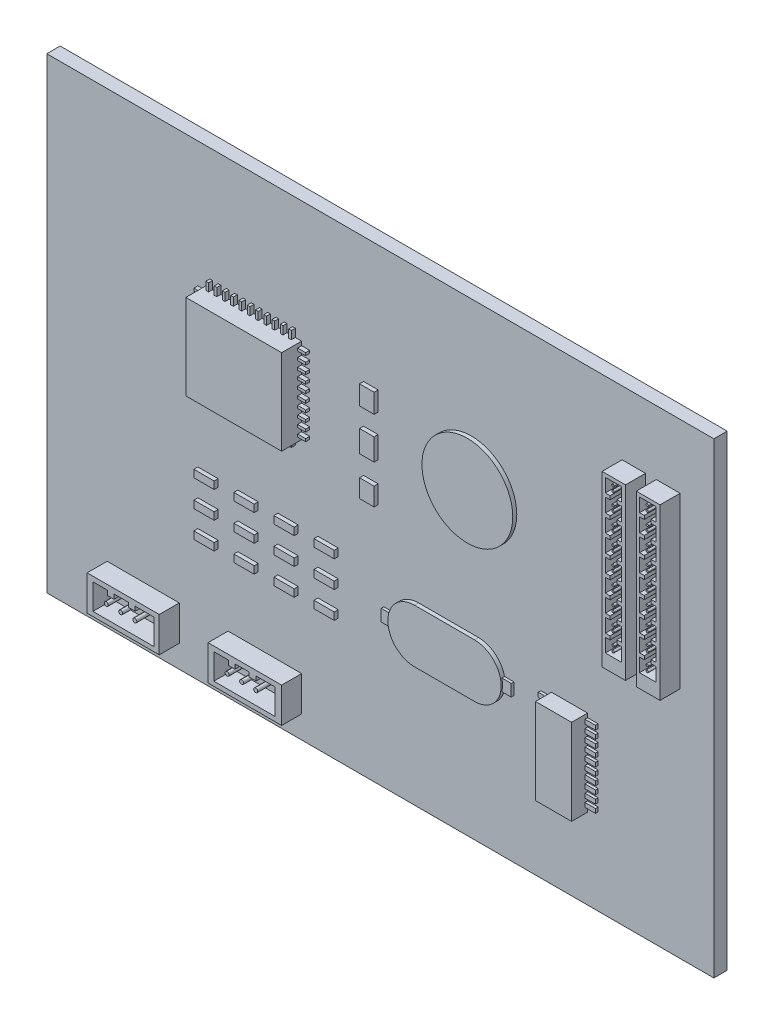
from build123d import *

# Parameters (mm, degrees)
SKETCH_1_W          = 50
SKETCH_1_H          = 35
EXTRUDE_1_DEPTH     = 1
SKETCH_2_W          = 7.176497208
SKETCH_2_H          = 6.396443163
SKETCH_2_W_2        = 5.406033325
SKETCH_2_H_2        = 2.621107066
SKETCH_2_W_3        = 5.514100591
SKETCH_2_W_4        = 1.753496487
SKETCH_2_H_3        = 12.698631261
SKETCH_2_W_5        = 1.780960435
EXTRUDE_2_DEPTH     = 1.5
SKETCH_3_R          = 3.403415583
SKETCH_3_W          = 0.2
SKETCH_3_H          = 0.6
SKETCH_3_W_2        = 0.6
SKETCH_3_H_2        = 0.2
SKETCH_3_W_3        = 1.52
SKETCH_3_H_3        = 0.553688952
SKETCH_3_W_4        = 1.08844173
SKETCH_3_H_4        = 1.44
SKETCH_3_H_5        = 1.641778418
SKETCH_3_H_6        = 1.356241209
EXTRUDE_3_DEPTH     = 0.3
SKETCH_4_R          = 0.15
SKETCH_4_R_2        = 0.085284689
CUT_EXTRUDE_1_DEPTH = 1.5
SKETCH_5_W          = 2.708520987
SKETCH_5_H          = 6.432737344
EXTRUDE_4_DEPTH     = 1.2
SKETCH_6_W          = 0.793035076
SKETCH_6_H          = 0.317513795
SKETCH_6_W_2        = 0.702600128
SKETCH_6_H_2        = 0.89036304
SKETCH_6_W_3        = 0.839915443
EXTRUDE_5_DEPTH     = 0.2


with BuildPart() as part:
    # 草图1 → 凸台-拉伸1 (new body)
    with BuildSketch(Plane.XY):
        Rectangle(SKETCH_1_W, SKETCH_1_H)
    extrude(amount=EXTRUDE_1_DEPTH)

    # 草图2 → 凸台-拉伸2 (add)
    with BuildSketch(Plane.XY.offset(1)):
        with Locations((-9.486885032, 5.195220798)):
            Rectangle(SKETCH_2_W, SKETCH_2_H)
        with Locations((-17.774382296, -14.497998462)):
            Rectangle(SKETCH_2_W_2, SKETCH_2_H_2)
        with Locations((-8.655686724, -14.497998462)):
            Rectangle(SKETCH_2_W_3, SKETCH_2_H_2)
        with Locations((18.999127982, 6.349315631)):
            Rectangle(SKETCH_2_W_4, SKETCH_2_H_3)
        with Locations((21.575662515, 6.349315631)):
            Rectangle(SKETCH_2_W_5, SKETCH_2_H_3)
    extrude(amount=EXTRUDE_2_DEPTH)

    # 草图3 → 凸台-拉伸3 (add)
    with BuildSketch(Plane.XY.offset(1)):
        with Locations((6.823687934, 5.195220797)):
            Circle(SKETCH_3_R)
        with Locations((-12.675133636, 8.693442379)):
            Rectangle(SKETCH_3_W, SKETCH_3_H)
        with Locations((-12.055133636, 8.693442379)):
            Rectangle(SKETCH_3_W, SKETCH_3_H)
        with Locations((-11.435133636, 8.693442379)):
            Rectangle(SKETCH_3_W, SKETCH_3_H)
        with Locations((-10.815133636, 8.693442379)):
            Rectangle(SKETCH_3_W, SKETCH_3_H)
        with Locations((-10.195133636, 8.693442379)):
            Rectangle(SKETCH_3_W, SKETCH_3_H)
        with Locations((-9.575133636, 8.693442379)):
            Rectangle(SKETCH_3_W, SKETCH_3_H)
        with Locations((-8.955133636, 8.693442379)):
            Rectangle(SKETCH_3_W, SKETCH_3_H)
        with Locations((-8.335133636, 8.693442379)):
            Rectangle(SKETCH_3_W, SKETCH_3_H)
        with Locations((-7.715133636, 8.693442379)):
            Rectangle(SKETCH_3_W, SKETCH_3_H)
        with Locations((-7.095133636, 8.693442379)):
            Rectangle(SKETCH_3_W, SKETCH_3_H)
        with Locations((-6.475133636, 8.693442379)):
            Rectangle(SKETCH_3_W, SKETCH_3_H)
        with Locations((-6.475133636, 1.696999216)):
            Rectangle(SKETCH_3_W, SKETCH_3_H)
        with Locations((-7.095133636, 1.696999216)):
            Rectangle(SKETCH_3_W, SKETCH_3_H)
        with Locations((-7.715133636, 1.696999216)):
            Rectangle(SKETCH_3_W, SKETCH_3_H)
        with Locations((-8.335133636, 1.696999216)):
            Rectangle(SKETCH_3_W, SKETCH_3_H)
        with Locations((-8.955133636, 1.696999216)):
            Rectangle(SKETCH_3_W, SKETCH_3_H)
        with Locations((-9.575133636, 1.696999216)):
            Rectangle(SKETCH_3_W, SKETCH_3_H)
        with Locations((-10.195133636, 1.696999216)):
            Rectangle(SKETCH_3_W, SKETCH_3_H)
        with Locations((-10.815133636, 1.696999216)):
            Rectangle(SKETCH_3_W, SKETCH_3_H)
        with Locations((-11.435133636, 1.696999216)):
            Rectangle(SKETCH_3_W, SKETCH_3_H)
        with Locations((-12.055133636, 1.696999216)):
            Rectangle(SKETCH_3_W, SKETCH_3_H)
        with Locations((-12.675133636, 1.696999216)):
            Rectangle(SKETCH_3_W, SKETCH_3_H)
        with Locations((-13.375133636, 7.993442379)):
            Rectangle(SKETCH_3_W_2, SKETCH_3_H_2)
        with Locations((-13.375133636, 7.373442379)):
            Rectangle(SKETCH_3_W_2, SKETCH_3_H_2)
        with Locations((-13.375133636, 6.753442379)):
            Rectangle(SKETCH_3_W_2, SKETCH_3_H_2)
        with Locations((-13.375133636, 6.133442379)):
            Rectangle(SKETCH_3_W_2, SKETCH_3_H_2)
        with Locations((-13.375133636, 5.513442379)):
            Rectangle(SKETCH_3_W_2, SKETCH_3_H_2)
        with Locations((-13.375133636, 4.893442379)):
            Rectangle(SKETCH_3_W_2, SKETCH_3_H_2)
        with Locations((-13.375133636, 4.273442379)):
            Rectangle(SKETCH_3_W_2, SKETCH_3_H_2)
        with Locations((-13.375133636, 3.653442379)):
            Rectangle(SKETCH_3_W_2, SKETCH_3_H_2)
        with Locations((-13.375133636, 3.033442379)):
            Rectangle(SKETCH_3_W_2, SKETCH_3_H_2)
        with Locations((-13.375133636, 2.413442379)):
            Rectangle(SKETCH_3_W_2, SKETCH_3_H_2)
        with Locations((-5.598636428, 2.413442379)):
            Rectangle(SKETCH_3_W_2, SKETCH_3_H_2)
        with Locations((-5.598636428, 3.033442379)):
            Rectangle(SKETCH_3_W_2, SKETCH_3_H_2)
        with Locations((-5.598636428, 3.653442379)):
            Rectangle(SKETCH_3_W_2, SKETCH_3_H_2)
        with Locations((-5.598636428, 4.273442379)):
            Rectangle(SKETCH_3_W_2, SKETCH_3_H_2)
        with Locations((-5.598636428, 4.893442379)):
            Rectangle(SKETCH_3_W_2, SKETCH_3_H_2)
        with Locations((-5.598636428, 5.513442379)):
            Rectangle(SKETCH_3_W_2, SKETCH_3_H_2)
        with Locations((-5.598636428, 6.133442379)):
            Rectangle(SKETCH_3_W_2, SKETCH_3_H_2)
        with Locations((-5.598636428, 6.753442379)):
            Rectangle(SKETCH_3_W_2, SKETCH_3_H_2)
        with Locations((-5.598636428, 7.373442379)):
            Rectangle(SKETCH_3_W_2, SKETCH_3_H_2)
        with Locations((-5.598636428, 7.993442379)):
            Rectangle(SKETCH_3_W_2, SKETCH_3_H_2)
        with Locations((-9.915133636, -3.941136856)):
            Rectangle(SKETCH_3_W_3, SKETCH_3_H_3)
        with Locations((-12.915133636, -3.941136856)):
            Rectangle(SKETCH_3_W_3, SKETCH_3_H_3)
        with Locations((-6.915133636, -3.941136856)):
            Rectangle(SKETCH_3_W_3, SKETCH_3_H_3)
        with Locations((-3.915133636, -3.941136856)):
            Rectangle(SKETCH_3_W_3, SKETCH_3_H_3)
        with Locations((-9.915133636, -5.941136856)):
            Rectangle(SKETCH_3_W_3, SKETCH_3_H_3)
        with Locations((-6.915133636, -5.941136856)):
            Rectangle(SKETCH_3_W_3, SKETCH_3_H_3)
        with Locations((-3.915133636, -5.941136856)):
            Rectangle(SKETCH_3_W_3, SKETCH_3_H_3)
        with Locations((-9.915133636, -7.941136856)):
            Rectangle(SKETCH_3_W_3, SKETCH_3_H_3)
        with Locations((-6.915133636, -7.941136856)):
            Rectangle(SKETCH_3_W_3, SKETCH_3_H_3)
        with Locations((-3.915133636, -7.941136856)):
            Rectangle(SKETCH_3_W_3, SKETCH_3_H_3)
        with Locations((-12.915133636, -5.941136856)):
            Rectangle(SKETCH_3_W_3, SKETCH_3_H_3)
        with Locations((-12.915133636, -7.941136856)):
            Rectangle(SKETCH_3_W_3, SKETCH_3_H_3)
        with BuildLine():
            Line((2.861883395, -8.217981332), (7.358028234, -8.217981332))
            ThreePointArc((7.358028234, -8.217981332), (9.358028234, -6.217981332), (7.358028234, -4.217981332))
            Line((7.358028234, -4.217981332), (2.861883395, -4.217981332))
            ThreePointArc((2.861883395, -4.217981332), (0.861883395, -6.217981332), (2.861883395, -8.217981332))
        make_face()
        with Locations((-0.710216203, 7.373442379)):
            Rectangle(SKETCH_3_W_4, SKETCH_3_H_4)
        with Locations((-0.710216203, 4.374331588)):
            Rectangle(SKETCH_3_W_4, SKETCH_3_H_5)
        with Locations((-0.710216203, 1.318878612)):
            Rectangle(SKETCH_3_W_4, SKETCH_3_H_6)
    extrude(amount=EXTRUDE_3_DEPTH)

    # 草图4 → 切除-拉伸1 (cut)
    # profile 1 of 4: a face of its own
    with BuildSketch(Plane.XY.offset(2.5)):
        Polygon((-18.466780594, -13.552666538), (-17.390825934, -13.552666538), (-17.390825934, -13.875964238), (-16.870429562, -13.875964238), (-16.870429562, -13.552666538), (-15.448688183, -13.552666538), (-15.448688183, -15.471795699), (-20.042348409, -15.471795699), (-20.042348409, -13.552666538), (-18.959047432, -13.552666538), (-18.959047432, -13.904093772), (-18.466780594, -13.904093772), align=None)
        with Locations((-19.043436033, -14.494813977)):
            Circle(SKETCH_4_R, mode=Mode.SUBTRACT)
        with Locations((-17.960448989, -14.494813977)):
            Circle(SKETCH_4_R, mode=Mode.SUBTRACT)
        with Locations((-16.905591479, -14.494813977)):
            Circle(SKETCH_4_R, mode=Mode.SUBTRACT)
    # profile 2 of 4: a face of its own
    with BuildSketch(Plane.XY.offset(2.5)):
        Polygon((-9.894385493, -13.904093772), (-9.402118655, -13.904093772), (-9.402118655, -13.552666538), (-8.326163995, -13.552666538), (-8.326163995, -13.875964238), (-7.805767624, -13.875964238), (-7.805767624, -13.552666538), (-6.384026244, -13.552666538), (-6.384026244, -15.471795699), (-10.97768647, -15.471795699), (-10.97768647, -13.552666538), (-9.894385493, -13.552666538), align=None)
        with Locations((-9.978774094, -14.494813977)):
            Circle(SKETCH_4_R, mode=Mode.SUBTRACT)
        with Locations((-8.895787051, -14.494813977)):
            Circle(SKETCH_4_R, mode=Mode.SUBTRACT)
        with Locations((-7.840929541, -14.494813977)):
            Circle(SKETCH_4_R, mode=Mode.SUBTRACT)
    # profile 3 of 4: a face of its own
    with BuildSketch(Plane.XY.offset(2.5)):
        Polygon((18.368011694, 10.119490376), (18.722895924, 10.119490376), (18.722895924, 9.853832917), (18.368011694, 9.853832917), (18.368011694, 8.819490376), (18.722895924, 8.819490376), (18.722895924, 8.553832917), (18.368011694, 8.553832917), (18.368011694, 7.519490376), (18.722895924, 7.519490376), (18.722895924, 7.253832917), (18.368011694, 7.253832917), (18.368011694, 6.219490376), (18.722895924, 6.219490376), (18.722895924, 5.953832917), (18.368011694, 5.953832917), (18.368011694, 4.919490376), (18.722895924, 4.919490376), (18.722895924, 4.653832917), (18.368011694, 4.653832917), (18.368011694, 3.619490376), (18.722895924, 3.619490376), (18.722895924, 3.353832917), (18.368011694, 3.353832917), (18.368011694, 2.319490376), (18.722895924, 2.319490376), (18.722895924, 2.053832917), (18.368011694, 2.053832917), (18.368011694, 1.032410051), (19.582580111, 1.032410051), (19.582580111, 2.053832917), (19.226820528, 2.053832917), (19.226820528, 2.319490376), (19.582580111, 2.319490376), (19.582580111, 3.353832917), (19.226820528, 3.353832917), (19.226820528, 3.619490376), (19.582580111, 3.619490376), (19.582580111, 4.653832917), (19.226820528, 4.653832917), (19.226820528, 4.919490376), (19.582580111, 4.919490376), (19.582580111, 5.953832917), (19.226820528, 5.953832917), (19.226820528, 6.219490376), (19.582580111, 6.219490376), (19.582580111, 7.253832917), (19.226820528, 7.253832917), (19.226820528, 7.519490376), (19.582580111, 7.519490376), (19.582580111, 8.553832917), (19.226820528, 8.553832917), (19.226820528, 8.819490376), (19.582580111, 8.819490376), (19.582580111, 9.853832917), (19.226820528, 9.853832917), (19.226820528, 10.119490376), (19.582580111, 10.119490376), (19.582580111, 11.153832917), (19.226820528, 11.153832917), (19.226820528, 11.419490376), (19.582580111, 11.419490376), (19.582580111, 12.437553818), (18.368011694, 12.437553818), (18.368011694, 11.419490376), (18.722895924, 11.419490376), (18.722895924, 11.153832917), (18.368011694, 11.153832917), align=None)
        with Locations((18.940766986, 12.200116898)):
            Circle(SKETCH_4_R_2, mode=Mode.SUBTRACT)
        with Locations((18.940766986, 11.804409499)):
            Circle(SKETCH_4_R_2, mode=Mode.SUBTRACT)
        with Locations((18.940766986, 10.900116898)):
            Circle(SKETCH_4_R_2, mode=Mode.SUBTRACT)
        with Locations((18.940766986, 10.504409499)):
            Circle(SKETCH_4_R_2, mode=Mode.SUBTRACT)
        with Locations((18.940766986, 9.600116898)):
            Circle(SKETCH_4_R_2, mode=Mode.SUBTRACT)
        with Locations((18.940766986, 9.204409499)):
            Circle(SKETCH_4_R_2, mode=Mode.SUBTRACT)
        with Locations((18.940766986, 8.300116898)):
            Circle(SKETCH_4_R_2, mode=Mode.SUBTRACT)
        with Locations((18.940766986, 7.904409499)):
            Circle(SKETCH_4_R_2, mode=Mode.SUBTRACT)
        with Locations((18.940766986, 7.000116898)):
            Circle(SKETCH_4_R_2, mode=Mode.SUBTRACT)
        with Locations((18.940766986, 6.604409499)):
            Circle(SKETCH_4_R_2, mode=Mode.SUBTRACT)
        with Locations((18.940766986, 5.700116898)):
            Circle(SKETCH_4_R_2, mode=Mode.SUBTRACT)
        with Locations((18.940766986, 5.304409499)):
            Circle(SKETCH_4_R_2, mode=Mode.SUBTRACT)
        with Locations((18.940766986, 4.400116898)):
            Circle(SKETCH_4_R_2, mode=Mode.SUBTRACT)
        with Locations((18.940766986, 4.004409499)):
            Circle(SKETCH_4_R_2, mode=Mode.SUBTRACT)
        with Locations((18.940766986, 3.100116898)):
            Circle(SKETCH_4_R_2, mode=Mode.SUBTRACT)
        with Locations((18.940766986, 2.704409499)):
            Circle(SKETCH_4_R_2, mode=Mode.SUBTRACT)
        with Locations((18.940766986, 1.800116898)):
            Circle(SKETCH_4_R_2, mode=Mode.SUBTRACT)
        with Locations((18.940766986, 1.404409499)):
            Circle(SKETCH_4_R_2, mode=Mode.SUBTRACT)
    # profile 4 of 4: a face of its own
    with BuildSketch(Plane.XY.offset(2.5)):
        Polygon((21.285698482, 11.419490376), (21.285698482, 11.153832917), (20.930814252, 11.153832917), (20.930814252, 10.119490376), (21.285698482, 10.119490376), (21.285698482, 9.853832917), (20.930814252, 9.853832917), (20.930814252, 8.819490376), (21.285698482, 8.819490376), (21.285698482, 8.553832917), (20.930814252, 8.553832917), (20.930814252, 7.519490376), (21.285698482, 7.519490376), (21.285698482, 7.253832917), (20.930814252, 7.253832917), (20.930814252, 6.219490376), (21.285698482, 6.219490376), (21.285698482, 5.953832917), (20.930814252, 5.953832917), (20.930814252, 4.919490376), (21.285698482, 4.919490376), (21.285698482, 4.653832917), (20.930814252, 4.653832917), (20.930814252, 3.619490376), (21.285698482, 3.619490376), (21.285698482, 3.353832917), (20.930814252, 3.353832917), (20.930814252, 2.319490376), (21.285698482, 2.319490376), (21.285698482, 2.053832917), (20.930814252, 2.053832917), (20.930814252, 1.032410051), (22.145382669, 1.032410051), (22.145382669, 2.053832917), (21.789623086, 2.053832917), (21.789623086, 2.319490376), (22.145382669, 2.319490376), (22.145382669, 3.353832917), (21.789623086, 3.353832917), (21.789623086, 3.619490376), (22.145382669, 3.619490376), (22.145382669, 4.653832917), (21.789623086, 4.653832917), (21.789623086, 4.919490376), (22.145382669, 4.919490376), (22.145382669, 5.953832917), (21.789623086, 5.953832917), (21.789623086, 6.219490376), (22.145382669, 6.219490376), (22.145382669, 7.253832917), (21.789623086, 7.253832917), (21.789623086, 7.519490376), (22.145382669, 7.519490376), (22.145382669, 8.553832917), (21.789623086, 8.553832917), (21.789623086, 8.819490376), (22.145382669, 8.819490376), (22.145382669, 9.853832917), (21.789623086, 9.853832917), (21.789623086, 10.119490376), (22.145382669, 10.119490376), (22.145382669, 11.153832917), (21.789623086, 11.153832917), (21.789623086, 11.419490376), (22.145382669, 11.419490376), (22.145382669, 12.437553818), (20.930814252, 12.437553818), (20.930814252, 11.419490376), align=None)
        with Locations((21.503569544, 10.504409499)):
            Circle(SKETCH_4_R_2, mode=Mode.SUBTRACT)
        with Locations((21.503569544, 1.800116898)):
            Circle(SKETCH_4_R_2, mode=Mode.SUBTRACT)
        with Locations((21.503569544, 11.804409499)):
            Circle(SKETCH_4_R_2, mode=Mode.SUBTRACT)
        with Locations((21.503569544, 7.000116898)):
            Circle(SKETCH_4_R_2, mode=Mode.SUBTRACT)
        with Locations((21.503569544, 9.204409499)):
            Circle(SKETCH_4_R_2, mode=Mode.SUBTRACT)
        with Locations((21.503569544, 9.600116898)):
            Circle(SKETCH_4_R_2, mode=Mode.SUBTRACT)
        with Locations((21.503569544, 6.604409499)):
            Circle(SKETCH_4_R_2, mode=Mode.SUBTRACT)
        with Locations((21.503569544, 1.404409499)):
            Circle(SKETCH_4_R_2, mode=Mode.SUBTRACT)
        with Locations((21.503569544, 12.200116898)):
            Circle(SKETCH_4_R_2, mode=Mode.SUBTRACT)
        with Locations((21.503569544, 5.304409499)):
            Circle(SKETCH_4_R_2, mode=Mode.SUBTRACT)
        with Locations((21.503569544, 5.700116898)):
            Circle(SKETCH_4_R_2, mode=Mode.SUBTRACT)
        with Locations((21.503569544, 4.400116898)):
            Circle(SKETCH_4_R_2, mode=Mode.SUBTRACT)
        with Locations((21.503569544, 10.900116898)):
            Circle(SKETCH_4_R_2, mode=Mode.SUBTRACT)
        with Locations((21.503569544, 3.100116898)):
            Circle(SKETCH_4_R_2, mode=Mode.SUBTRACT)
        with Locations((21.503569544, 4.004409499)):
            Circle(SKETCH_4_R_2, mode=Mode.SUBTRACT)
        with Locations((21.503569544, 2.704409499)):
            Circle(SKETCH_4_R_2, mode=Mode.SUBTRACT)
        with Locations((21.503569544, 8.300116898)):
            Circle(SKETCH_4_R_2, mode=Mode.SUBTRACT)
        with Locations((21.503569544, 7.904409499)):
            Circle(SKETCH_4_R_2, mode=Mode.SUBTRACT)
    extrude(amount=-CUT_EXTRUDE_1_DEPTH, mode=Mode.SUBTRACT)

    # 草图5 → 凸台-拉伸4 (add)
    with BuildSketch(Plane.XY.offset(1)):
        with Locations((14.180833313, -8.251329003)):
            Rectangle(SKETCH_5_W, SKETCH_5_H)
    extrude(amount=EXTRUDE_4_DEPTH)

    # 草图6 → 凸台-拉伸5 (add)
    with BuildSketch(Plane.XY.offset(1)):
        with Locations((15.931611344, -5.493427279)):
            Rectangle(SKETCH_6_W, SKETCH_6_H)
        with Locations((15.931611344, -6.093427279)):
            Rectangle(SKETCH_6_W, SKETCH_6_H)
        with Locations((15.931611344, -6.693427279)):
            Rectangle(SKETCH_6_W, SKETCH_6_H)
        with Locations((15.931611344, -7.293427279)):
            Rectangle(SKETCH_6_W, SKETCH_6_H)
        with Locations((15.931611344, -7.893427279)):
            Rectangle(SKETCH_6_W, SKETCH_6_H)
        with Locations((15.931611344, -8.493427279)):
            Rectangle(SKETCH_6_W, SKETCH_6_H)
        with Locations((15.931611344, -9.093427279)):
            Rectangle(SKETCH_6_W, SKETCH_6_H)
        with Locations((15.931611344, -9.693427278)):
            Rectangle(SKETCH_6_W, SKETCH_6_H)
        with Locations((15.931611344, -10.293427279)):
            Rectangle(SKETCH_6_W, SKETCH_6_H)
        with Locations((15.931611344, -10.893427279)):
            Rectangle(SKETCH_6_W, SKETCH_6_H)
        with Locations((12.430055281, -10.893427279)):
            Rectangle(SKETCH_6_W, SKETCH_6_H)
        with Locations((12.430055281, -10.293427279)):
            Rectangle(SKETCH_6_W, SKETCH_6_H)
        with Locations((12.430055281, -9.693427278)):
            Rectangle(SKETCH_6_W, SKETCH_6_H)
        with Locations((12.430055281, -9.093427279)):
            Rectangle(SKETCH_6_W, SKETCH_6_H)
        with Locations((12.430055281, -8.493427279)):
            Rectangle(SKETCH_6_W, SKETCH_6_H)
        with Locations((12.430055281, -7.893427279)):
            Rectangle(SKETCH_6_W, SKETCH_6_H)
        with Locations((12.430055281, -7.293427279)):
            Rectangle(SKETCH_6_W, SKETCH_6_H)
        with Locations((12.430055281, -6.693427279)):
            Rectangle(SKETCH_6_W, SKETCH_6_H)
        with Locations((12.430055281, -6.093427279)):
            Rectangle(SKETCH_6_W, SKETCH_6_H)
        with Locations((12.430055281, -5.493427279)):
            Rectangle(SKETCH_6_W, SKETCH_6_H)
        with Locations((9.658583673, -6.215498375)):
            Rectangle(SKETCH_6_W_2, SKETCH_6_H_2)
        with Locations((0.686290909, -6.215498375)):
            Rectangle(SKETCH_6_W_3, SKETCH_6_H_2)
    extrude(amount=EXTRUDE_5_DEPTH)


solid = part.part
